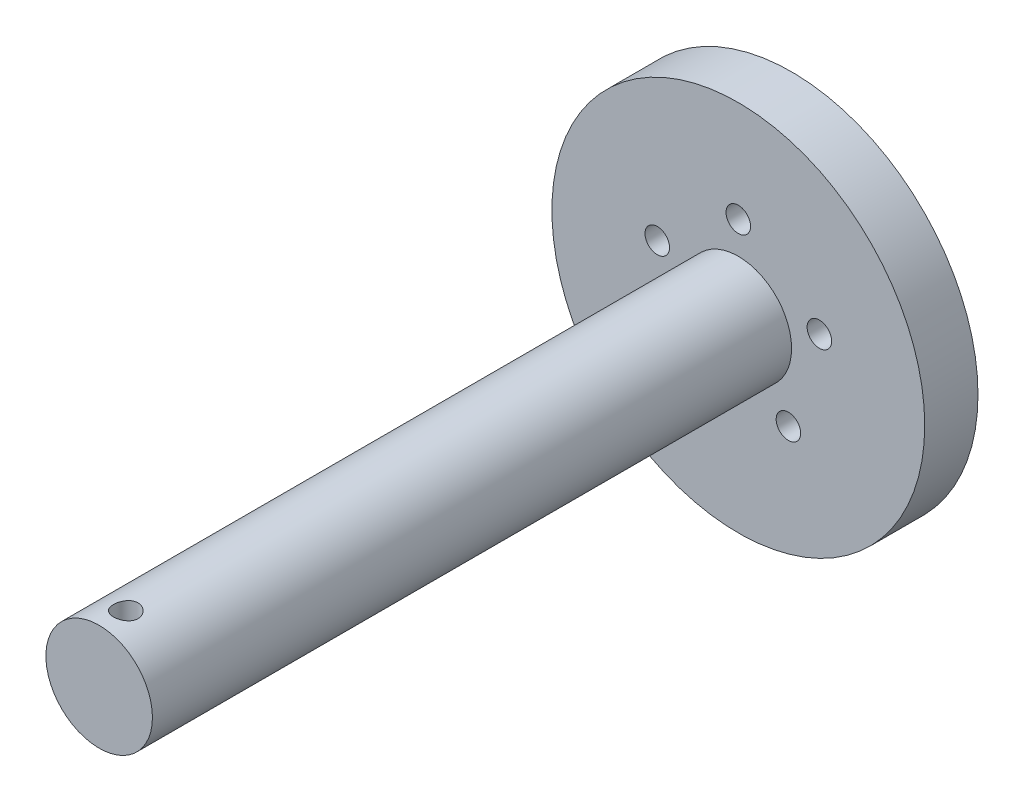
from build123d import *

# Parameters (mm, degrees)
SKETCH1_R           = 44.45
SKETCH1_R_2         = 2.921
BOSS_EXTRUDE1_DEPTH = 12.7
SKETCH2_R           = 12.7
BOSS_EXTRUDE2_DEPTH = 152.4
CUT_EXTRUDE1_REACH  = 182.277
SKETCH4_R           = 2.921


with BuildPart() as part:
    # Sketch1 → Boss-Extrude1 (new body)
    with BuildSketch(Plane.XY):
        Circle(SKETCH1_R)
        with Locations((0, 20.32)):
            Circle(SKETCH1_R_2, mode=Mode.SUBTRACT)
        with Locations((19.325468411, 6.279225326)):
            Circle(SKETCH1_R_2, mode=Mode.SUBTRACT)
        with Locations((11.943796327, -16.439225326)):
            Circle(SKETCH1_R_2, mode=Mode.SUBTRACT)
        with Locations((-11.943796327, -16.439225326)):
            Circle(SKETCH1_R_2, mode=Mode.SUBTRACT)
        with Locations((-19.325468411, 6.279225326)):
            Circle(SKETCH1_R_2, mode=Mode.SUBTRACT)
    extrude(amount=BOSS_EXTRUDE1_DEPTH)

    # Sketch2 → Boss-Extrude2 (add)
    with BuildSketch(Plane.XY.offset(12.7)):
        with Locations(Location((0, 0, 0), (0, 0, 180))):
            Circle(SKETCH2_R)
    extrude(amount=BOSS_EXTRUDE2_DEPTH)

    # Sketch4 → Cut-Extrude1 (cut, up to next)
    with BuildSketch(Plane(origin=(0, -12.7, 0), x_dir=(-1, 0, 0), z_dir=(0, -1, 0)), mode=Mode.PRIVATE) as cut_extrude1_sk1:
        with Locations(Location((0, -158.75, 0), (0, 0, 90))):
            Circle(SKETCH4_R)
    cut_extrude1_tool1 = extrude(cut_extrude1_sk1.sketch, amount=-CUT_EXTRUDE1_REACH, mode=Mode.PRIVATE) & part.part
    add(cut_extrude1_tool1.solids().sort_by_distance((0, -12.7, 158.75))[0], mode=Mode.SUBTRACT)


solid = part.part
